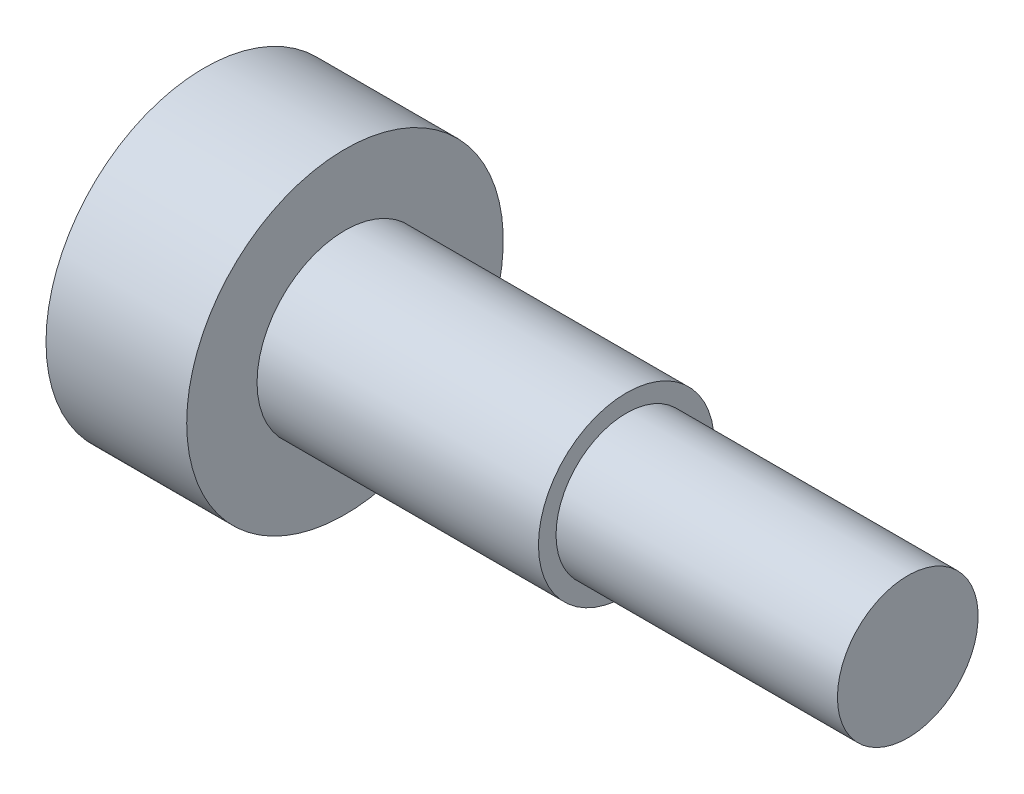
from build123d import *

# Parameters (mm, degrees)
CUT_EXTRUDE1_DEPTH = 2.5


with BuildPart() as part:
    # Sketch1 → Revolve1 (revolve)
    with BuildSketch(Plane.XY, mode=Mode.PRIVATE) as revolve1_sk:
        Polygon((4, 4.5), (0, 4.5), (0, 0), (20, 0), (20, 2), (12, 2), (12, 2.5), (4, 2.5), align=None)
    revolve(revolve1_sk.sketch.rotate(Axis((-20, 0, 0), (1, 0, 0)), 90), axis=Axis((-20, 0, 0), (1, 0, 0)))

    # Sketch2 → Cut-Extrude1 (cut)
    with BuildSketch(Plane.ZY):
        Polygon((1.443375673, 0), (0.721687836, 1.25), (-0.721687836, 1.25), (-1.443375673, 0), (-0.721687836, -1.25), (0.721687836, -1.25), align=None)
    extrude(amount=-CUT_EXTRUDE1_DEPTH, mode=Mode.SUBTRACT)


solid = part.part
